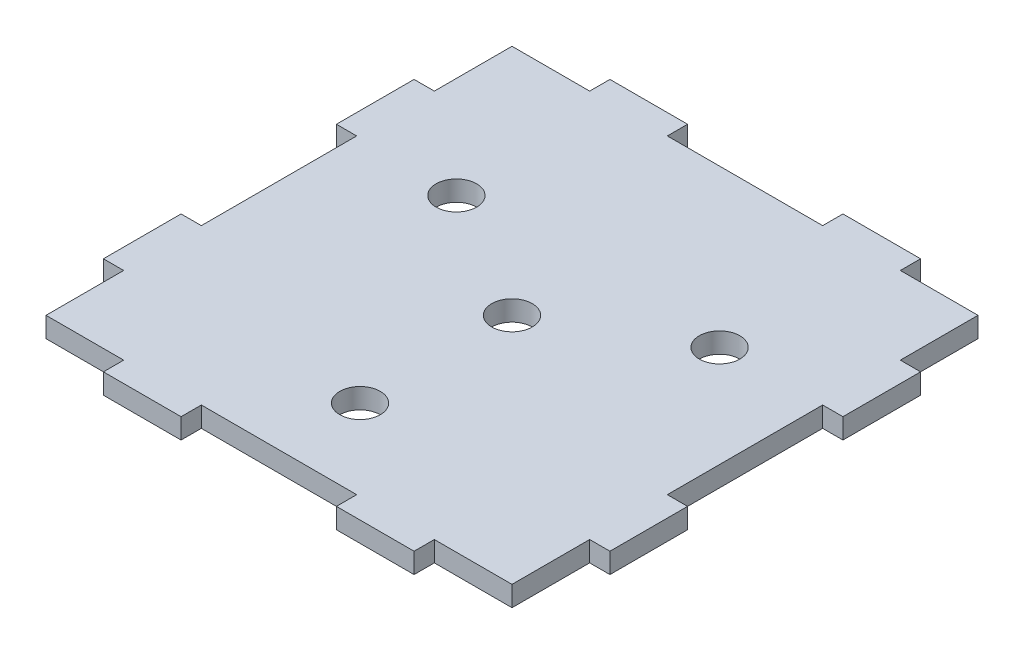
from build123d import *

# Parameters (mm, degrees)
BOSS_EXTRUDE1_DEPTH = 6
SKETCH2_R           = 6
CUT_EXTRUDE1_DEPTH  = 107.235587258
CIRPATTERN1_COUNT   = 3


with BuildPart() as part:
    # Sketch1 → Boss-Extrude1 (new body)
    with BuildSketch(Plane(origin=(0, 0, 0), x_dir=(1, 0, 0), z_dir=(0, 1, 0))):
        Polygon((0, 69), (-23, 69), (-23, 75), (-46, 75), (-46, 69), (-69, 69), (-69, 46), (-75, 46), (-75, 23), (-69, 23), (-69, 0), (-69, -23), (-75, -23), (-75, -46), (-69, -46), (-69, -69), (-46, -69), (-46, -75), (-23, -75), (-23, -69), (0, -69), (23, -69), (23, -75), (46, -75), (46, -69), (69, -69), (69, -46), (75, -46), (75, -23), (69, -23), (69, 0), (69, 23), (75, 23), (75, 46), (69, 46), (69, 69), (46, 69), (46, 75), (23, 75), (23, 69), align=None)
    extrude(amount=BOSS_EXTRUDE1_DEPTH)

    # Sketch2 → Cut-Extrude1 (cut, through all)
    with BuildSketch(Plane(origin=(0, 6, 0), x_dir=(1, 0, 0), z_dir=(0, 1, 0))):
        with Locations(Location((0, 0, 0), (0, 0, 270))):
            Circle(SKETCH2_R)
        with Locations(Location((0, -45, 0), (0, 0, 270))):
            Circle(SKETCH2_R)
    cut_extrude1 = extrude(amount=-CUT_EXTRUDE1_DEPTH, mode=Mode.SUBTRACT)

    # CirPattern1: Cut-Extrude1 ×3 about axis
    cirpattern1_axis = Axis((0, 0, 0), (0, 1, 0))
    for i in range(1, CIRPATTERN1_COUNT):
        add(cut_extrude1.rotate(cirpattern1_axis, i * 360 / CIRPATTERN1_COUNT), mode=Mode.SUBTRACT)


solid = part.part
